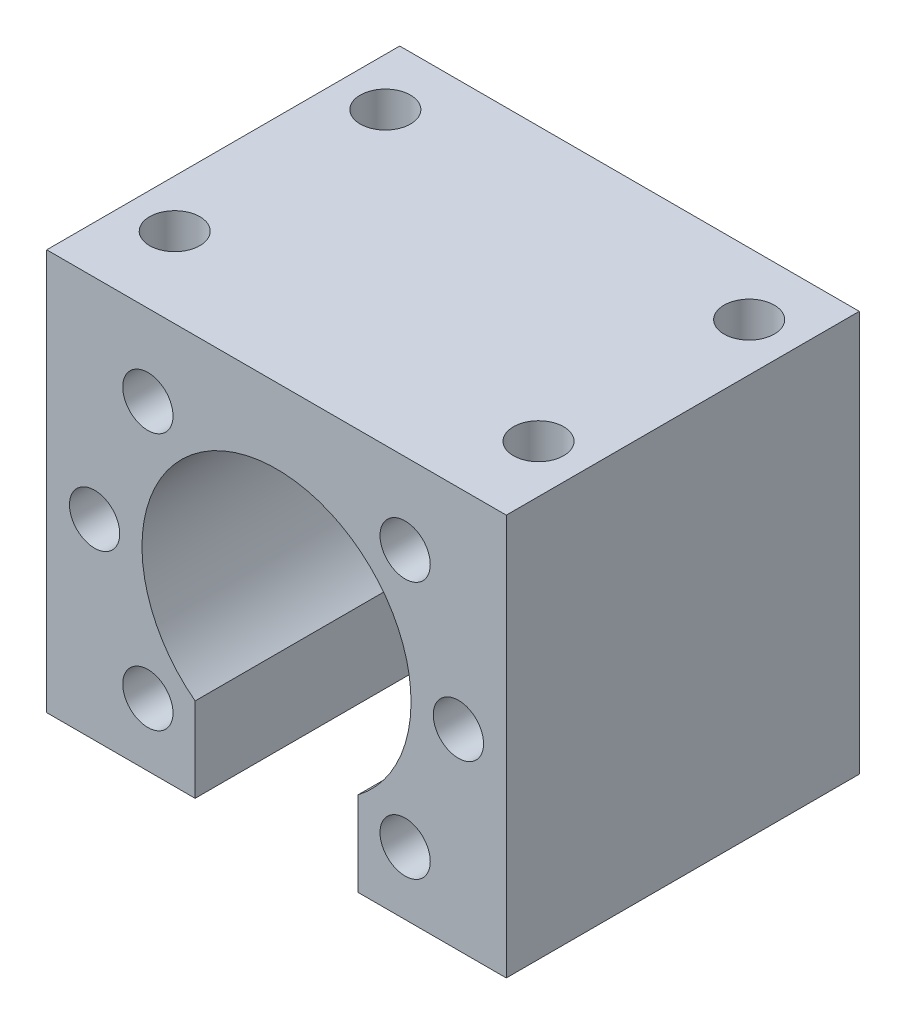
from build123d import *
from build123d.topology import SkipClean

# Parameters (mm, degrees)
EXTRUSION1_DEPTH = 36.869499995
THREAD6_D        = 5.25
THREAD6_DEPTH    = 20
THREAD6_TIP      = 1.577259125
THREAD10_D       = 5.25
THREAD10_DEPTH   = 17
SKETCH6_W        = 48
SKETCH6_H        = 36.869499995
SKETCH6_R        = 2.625
EXTRUSION2_DEPTH = 1.869499995


with BuildPart() as part:
    # Sketch1 → Extrusion1 (new body)
    with BuildSketch(Plane.XY):
        with BuildLine():
            Line((-24, 20), (24, 20))
            Line((24, 20), (24, -20))
            Line((24, -20), (8.5, -20))
            Line((8.5, -20), (8.5, -11.187157816))
            ThreePointArc((8.5, -11.187157816), (0, 14.05), (-8.5, -11.187157816))
            Line((-8.5, -11.187157816), (-8.5, -20))
            Line((-8.5, -20), (-24, -20))
            Line((-24, -20), (-24, 20))
        make_face()
    extrude(amount=EXTRUSION1_DEPTH)

    # Thread6
    with Locations(Plane.XY.offset(36.869499995)):
        with Locations((-19, 0), (-13.435028843, -13.435028843), (-13.435028843, 13.435028843), (13.435028843, 13.435028843), (19, 0), (13.435028843, -13.435028843)):
            Hole(THREAD6_D / 2, depth=THREAD6_DEPTH)
            with Locations((0, 0, -(THREAD6_DEPTH + THREAD6_TIP / 2))):  # 118° drill point
                Cone(0, THREAD6_D / 2, THREAD6_TIP, mode=Mode.SUBTRACT)

    # Thread10
    with Locations(Plane(origin=(0, 20, 0), x_dir=(1, 0, 0), z_dir=(0, 1, 0))):
        with Locations((-19, -6.5), (19, -6.5), (-19, -28.5), (19, -28.5)):
            Hole(THREAD10_D / 2, depth=THREAD10_DEPTH)

    # Sketch6 → Extrusion2 (add)
    with SkipClean():  # the faces are left unmerged after this step: merging them gives an invalid solid
        with BuildSketch(Plane(origin=(0, 20, 0), x_dir=(-1, 0, 0), z_dir=(0, 1, 0))):
            with Locations((0, 18.434749998)):
                Rectangle(SKETCH6_W, SKETCH6_H)
            with Locations(Location((19, 28.5, 0), (0, 0, 90))):
                Circle(SKETCH6_R, mode=Mode.SUBTRACT)
            with Locations(Location((19, 6.5, 0), (0, 0, 90))):
                Circle(SKETCH6_R, mode=Mode.SUBTRACT)
            with Locations(Location((-19, 6.5, 0), (0, 0, 90))):
                Circle(SKETCH6_R, mode=Mode.SUBTRACT)
            with Locations(Location((-19, 28.5, 0), (0, 0, 90))):
                Circle(SKETCH6_R, mode=Mode.SUBTRACT)
        extrude(amount=EXTRUSION2_DEPTH)


solid = part.part
